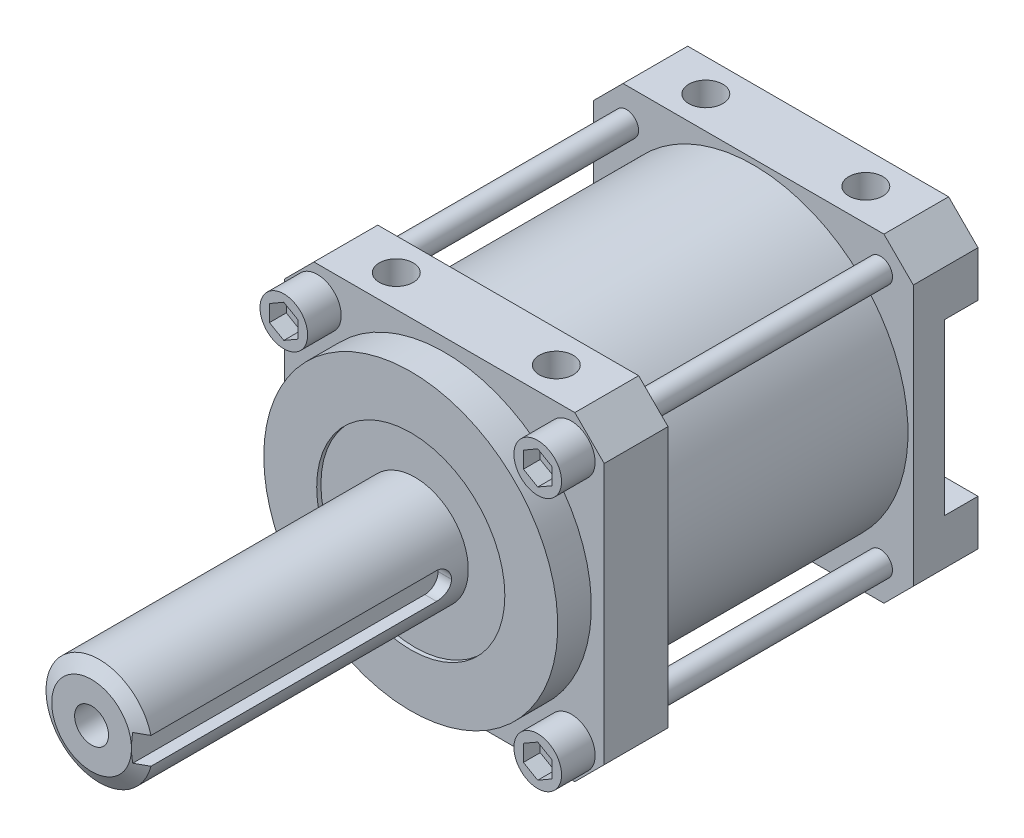
from build123d import *

# Parameters (mm, degrees)
RESSALTO_EXTRUS_O1_DEPTH                      = 7.7
ESBO_O4_W                                     = 18.4
ESBO_O4_H                                     = 29.2
ESBO_O3_R                                     = 6.45
CORTE_EXTRUS_O1_DEPTH                         = 9.9
RESSALTO_EXTRUS_O2_DEPTH                      = 7.6
CORTE_EXTRUS_O2_DEPTH                         = 4
BROCA_DE_ROSQUEAR_PARA_TARRAXA_DE_10_32_D     = 4.0386
BROCA_DE_ROSQUEAR_PARA_TARRAXA_DE_10_32_DEPTH = 7.62
BROCA_DE_ROSQUEAR_PARA_TARRAXA_DE_10_32_TIP   = 1.213317848
ESBO_O9_W                                     = 1.795576077
ESBO_O9_H                                     = 3.175
CORTE_EXTRUS_O3_DEPTH                         = 36.5
FILETE1_R                                     = 1.58
BROCA_DE_ROSQUEAR_PARA_TARRAXA_DE_1_2_A_COUNT = 2
BROCA_DE_ROSQUEAR_PARA_TARRAXA_DE_1_2_A_PITCH = 19.05
BROCA_DE_ROSQUEAR_PARA_TARRAXA_DE_1_3_COUNT   = 2
BROCA_DE_ROSQUEAR_PARA_TARRAXA_DE_1_3_PITCH   = 41.482827772
BROCA_DE_ROSQUEAR_PARA_TARRAXA_DE_1_4_COUNT   = 2
BROCA_DE_ROSQUEAR_PARA_TARRAXA_DE_1_4_PITCH   = 36.85
BROCA_DE_ROSQUEAR_PARA_TARRAXA_DE_6_401_D     = 2.8702
CORTE_EXTRUS_O4_DEPTH                         = 2
ESPELHAR1_COPY_2_DEPTH                        = 2
ESCAREADO_PARA_PARAFUSO_DE_M_QUINA_C_2_COUNT  = 2
ESCAREADO_PARA_PARAFUSO_DE_M_QUINA_C_2_PITCH  = 25


with BuildPart() as part:
    # Esboço2 → Ressalto-extrusão1 (new body)
    with BuildSketch(Plane.XY):
        Polygon((-19.03, 15.53), (-15.53, 19.03), (15.53, 19.03), (19.03, 15.53), (19.03, -15.53), (15.53, -19.03), (-15.53, -19.03), (-19.03, -15.53), align=None)
    extrude(amount=RESSALTO_EXTRUS_O1_DEPTH)

    # Esboço4 → Revolução1 (revolve)
    with BuildSketch(Plane(origin=(0, 0, 0), x_dir=(1, 0, 0), z_dir=(0, 1, 0)), mode=Mode.PRIVATE) as revolu_o1_sk:
        with Locations((9.2, -22.3)):
            Rectangle(ESBO_O4_W, ESBO_O4_H)
        Polygon((0, -44.5), (17.5, -44.5), (17.5, -48.5), (11.2, -48.5), (11.2, -48), (6.35, -48), (6.35, -85.576239569), (4.75, -86.5), (0, -86.5), align=None)
    revolve(revolu_o1_sk.sketch.rotate(Axis((0, 0, -5.757774852), (0, 0, 1)), 180), axis=Axis((0, 0, -5.757774852), (0, 0, 1)))


with BuildPart() as revolu_o1_piece_1:
    # of the separate pieces the step leaves, piece 1, a body of its own (revolu_o1_pieces)
    add(part.part.solids().sort_by_distance((-19.03, 15.53, 0))[0])

    # Esboço3 → Corte-extrusão1 (cut)
    with BuildSketch(Plane(origin=(0, 0, 0), x_dir=(-1, 0, 0), z_dir=(0, 0, -1))):
        Circle(ESBO_O3_R)
    extrude(amount=-CORTE_EXTRUS_O1_DEPTH, mode=Mode.SUBTRACT)



with BuildPart() as revolu_o1_piece_2:
    # of the separate pieces the step leaves, piece 2, a body of its own (revolu_o1_pieces)
    add(part.part.solids().sort_by_distance((-17.5, 0, 44.5))[0])


with BuildPart() as revolu_o1_piece_1_1:
    add(revolu_o1_piece_1.part)

    add(revolu_o1_piece_2.part)  # Ressalto-extrusão2 merges Revolução1 piece 2
    # Esboço5 → Ressalto-extrusão2 (add)
    with BuildSketch(Plane.XY.offset(36.9)):
        Polygon((-15.53, 19.03), (-19.03, 15.53), (-19.03, -15.53), (-15.53, -19.03), (15.53, -19.03), (19.03, -15.53), (19.03, 15.53), (15.53, 19.03), align=None)
    extrude(amount=RESSALTO_EXTRUS_O2_DEPTH)

    # Esboço6 → Corte-extrusão2 (cut)
    with BuildSketch(Plane(origin=(0, 0, 0), x_dir=(-1, 0, 0), z_dir=(0, 0, -1))):
        with BuildLine():
            Line((-19.03, -10.1), (-19.03, 10.1))
            Line((-19.03, 10.1), (-9.012713751, 10.1))
            ThreePointArc((-9.012713751, 10.1), (-6.090453498, 8.288387911), (-6.413345842, 4.865336074))
            ThreePointArc((-6.413345842, 4.865336074), (-8.05, 0), (-6.413345842, -4.865336074))
            ThreePointArc((-6.413345842, -4.865336074), (-6.090453498, -8.288387911), (-9.012713751, -10.1))
            Line((-9.012713751, -10.1), (-19.03, -10.1))
        make_face()
        with BuildLine():
            Line((19.03, -10.1), (9.012713751, -10.1))
            ThreePointArc((9.012713751, -10.1), (6.090453498, -8.288387911), (6.413345842, -4.865336074))
            ThreePointArc((6.413345842, -4.865336074), (8.05, 0), (6.413345842, 4.865336074))
            ThreePointArc((6.413345842, 4.865336074), (6.090453498, 8.288387911), (9.012713751, 10.1))
            Line((9.012713751, 10.1), (19.03, 10.1))
            Line((19.03, 10.1), (19.03, -10.1))
        make_face()
    extrude(amount=-CORTE_EXTRUS_O2_DEPTH, mode=Mode.SUBTRACT)

    # Broca de rosquear para tarraxa de _10-32
    with Locations(Plane.XY.offset(86.5)):
        with Locations((0, 0)):
            Hole(BROCA_DE_ROSQUEAR_PARA_TARRAXA_DE_10_32_D / 2, depth=BROCA_DE_ROSQUEAR_PARA_TARRAXA_DE_10_32_DEPTH)
            with Locations((0, 0, -(BROCA_DE_ROSQUEAR_PARA_TARRAXA_DE_10_32_DEPTH + BROCA_DE_ROSQUEAR_PARA_TARRAXA_DE_10_32_TIP / 2))):  # 118° drill point
                Cone(0, BROCA_DE_ROSQUEAR_PARA_TARRAXA_DE_10_32_D / 2, BROCA_DE_ROSQUEAR_PARA_TARRAXA_DE_10_32_TIP, mode=Mode.SUBTRACT)

    # Esboço9 → Corte-extrusão3 (cut)
    with BuildSketch(Plane.XY.offset(86.5)):
        with Locations((5.647788038, 0)):
            Rectangle(ESBO_O9_W, ESBO_O9_H)
    extrude(amount=-CORTE_EXTRUS_O3_DEPTH, mode=Mode.SUBTRACT)

    # Filete1
    filete1_edges = [revolu_o1_piece_1_1.edges().sort_by_distance(p)[0] for p in [
        (5.449180531, 1.5875, 50),
        (5.449180531, -1.5875, 50),
    ]]
    fillet(filete1_edges, radius=FILETE1_R)

    # Esboço11 → Broca de rosquear para tarraxa de _1 2 (revolve, cut)
    with BuildSketch(Plane(origin=(9.525, 19.03, 3.85), x_dir=(0, 0, 1), z_dir=(1, 0, 0))):
        Polygon((0, 0), (0, 8.833317848), (2.0193, 7.62), (2.0193, 0), align=None)
    broca_de_rosquear_para_tarraxa_de_1_2 = revolve(axis=Axis((9.525, 25.38, 3.85), (0, -1, 0)), mode=Mode.SUBTRACT)

    # Broca de rosquear para tarraxa de _1 2 a: Broca de rosquear para tarraxa de _1 2 ×2
    with Locations(*[(-i * BROCA_DE_ROSQUEAR_PARA_TARRAXA_DE_1_2_A_PITCH, 0, 0) for i in range(1, BROCA_DE_ROSQUEAR_PARA_TARRAXA_DE_1_2_A_COUNT)]):
        add(broca_de_rosquear_para_tarraxa_de_1_2, mode=Mode.SUBTRACT)

    # Broca de rosquear para tarraxa de _1 3: Broca de rosquear para tarraxa de _1 2 ×2
    with Locations(*[Vector(-0.45922616713812264, 0, 0.8883193836766308) * (i * BROCA_DE_ROSQUEAR_PARA_TARRAXA_DE_1_3_PITCH) for i in range(1, BROCA_DE_ROSQUEAR_PARA_TARRAXA_DE_1_3_COUNT)]):
        add(broca_de_rosquear_para_tarraxa_de_1_2, mode=Mode.SUBTRACT)

    # Broca de rosquear para tarraxa de _1 4: Broca de rosquear para tarraxa de _1 2 ×2
    with Locations(*[(0, 0, i * BROCA_DE_ROSQUEAR_PARA_TARRAXA_DE_1_4_PITCH) for i in range(1, BROCA_DE_ROSQUEAR_PARA_TARRAXA_DE_1_4_COUNT)]):
        add(broca_de_rosquear_para_tarraxa_de_1_2, mode=Mode.SUBTRACT)

    # Espelhar3: Broca de rosquear para tarraxa de _1 2 across plane
    add(broca_de_rosquear_para_tarraxa_de_1_2.mirror(Plane.ZX), mode=Mode.SUBTRACT)

    # Espelhar3 copy 1 sketch → Espelhar3 copy 1 (revolve, cut)
    with BuildSketch(Plane(origin=(-9.525, -19.03, 3.85), x_dir=(0, 0, 1), z_dir=(1, 0, 0))):
        Polygon((0, 0), (0, -8.833317848), (2.0193, -7.62), (2.0193, 0), align=None)
    revolve(axis=Axis((-9.525, -25.38, 3.85), (0, -1, 0)), mode=Mode.SUBTRACT)

    # Espelhar3 copy 2 sketch → Espelhar3 copy 2 (revolve, cut)
    with BuildSketch(Plane(origin=(-9.525, -19.03, 40.7), x_dir=(0, 0, 1), z_dir=(1, 0, 0))):
        Polygon((0, 0), (0, -8.833317848), (2.0193, -7.62), (2.0193, 0), align=None)
    revolve(axis=Axis((-9.525, -25.38, 40.7), (0, -1, 0)), mode=Mode.SUBTRACT)

    # Espelhar3 copy 3 sketch → Espelhar3 copy 3 (revolve, cut)
    with BuildSketch(Plane(origin=(9.525, -19.03, 40.7), x_dir=(0, 0, 1), z_dir=(1, 0, 0))):
        Polygon((0, 0), (0, -8.833317848), (2.0193, -7.62), (2.0193, 0), align=None)
    revolve(axis=Axis((9.525, -25.38, 40.7), (0, -1, 0)), mode=Mode.SUBTRACT)

    # Broca de rosquear para tarraxa de #6-401 (through all)
    with Locations(Plane(origin=(0, 0, 0), x_dir=(-1, 0, 0), z_dir=(0, 0, -1))):
        with Locations((-15.115, 15.115), (15.115, 15.115), (15.115, -15.115), (-15.115, -15.115)):
            Hole(BROCA_DE_ROSQUEAR_PARA_TARRAXA_DE_6_401_D / 2)

    # Esboço16 → Revolução2 (revolve)
    with BuildSketch(Plane(origin=(0, 15.115, 0), x_dir=(1, 0, 0), z_dir=(0, 1, 0))):
        Polygon((15.115, 0.5), (16.5501, 0.5), (16.5501, -44.5), (17.95, -44.5), (17.95, -48.5), (15.115, -48.5), align=None)
    revolu_o2 = revolve(axis=Axis((15.115, 15.115, 60.999619422), (0, 0, -1)))

    # Esboço17 → Corte-extrusão4 (cut)
    with BuildSketch(Plane.XY.offset(48.5)):
        Polygon((13.410197167, 16.099268375), (13.410197167, 14.130731625), (15.115, 13.146463251), (16.819802833, 14.130731625), (16.819802833, 16.099268375), (15.115, 17.083536749), align=None)
    corte_extrus_o4 = extrude(amount=-CORTE_EXTRUS_O4_DEPTH, mode=Mode.SUBTRACT)

    # Espelhar2: Revolução2, Corte-extrusão4 across plane
    add(revolu_o2.mirror(Plane(origin=(0, 0, 0), x_dir=(0, 0, 1), z_dir=(1, 0, 0))))
    add(corte_extrus_o4.mirror(Plane(origin=(0, 0, 0), x_dir=(0, 0, 1), z_dir=(1, 0, 0))), mode=Mode.SUBTRACT)

    # Espelhar1: Revolução2, Corte-extrusão4 across plane
    add(revolu_o2.mirror(Plane.ZX))
    add(corte_extrus_o4.mirror(Plane.ZX), mode=Mode.SUBTRACT)

    # Espelhar1 copy 1 sketch → Espelhar1 copy 1 (revolve)
    with BuildSketch(Plane(origin=(0, -15.115, 0), x_dir=(-1, 0, 0), z_dir=(0, -1, 0))):
        Polygon((15.115, 0.5), (16.5501, 0.5), (16.5501, -44.5), (17.95, -44.5), (17.95, -48.5), (15.115, -48.5), align=None)
    revolve(axis=Axis((-15.115, -15.115, 60.999619422), (0, 0, -1)))

    # Espelhar1 copy 2 sketch → Espelhar1 copy 2 (cut)
    with BuildSketch(Plane(origin=(0, 0, 48.5), x_dir=(-1, 0, 0), z_dir=(0, 0, 1))):
        Polygon((13.410197167, 16.099268375), (13.410197167, 14.130731625), (15.115, 13.146463251), (16.819802833, 14.130731625), (16.819802833, 16.099268375), (15.115, 17.083536749), align=None)
    extrude(amount=-ESPELHAR1_COPY_2_DEPTH, mode=Mode.SUBTRACT)

    # Esboço19 → Escareado para parafuso de máquina com cabeça chata de #51 (revolve, cut)
    with BuildSketch(Plane(origin=(0, 12.5, 7.7), x_dir=(0, -1, 0), z_dir=(1, 0, 0))):
        Polygon((0, 0), (0, 8.2), (1.63195, 8.2), (1.63195, 1.804295328), (3.2004, 0), align=None)
    escareado_para_parafuso_de_m_quina_com_c = revolve(axis=Axis((0, 12.5, 14.05), (0, 0, -1)), mode=Mode.SUBTRACT)

    # Escareado para parafuso de m_quina c 2: Escareado para parafuso de máquina com cabeça chata de #51 ×2
    with Locations(*[(0, -i * ESCAREADO_PARA_PARAFUSO_DE_M_QUINA_C_2_PITCH, 0) for i in range(1, ESCAREADO_PARA_PARAFUSO_DE_M_QUINA_C_2_COUNT)]):
        add(escareado_para_parafuso_de_m_quina_com_c, mode=Mode.SUBTRACT)


solid = revolu_o1_piece_1_1.part
